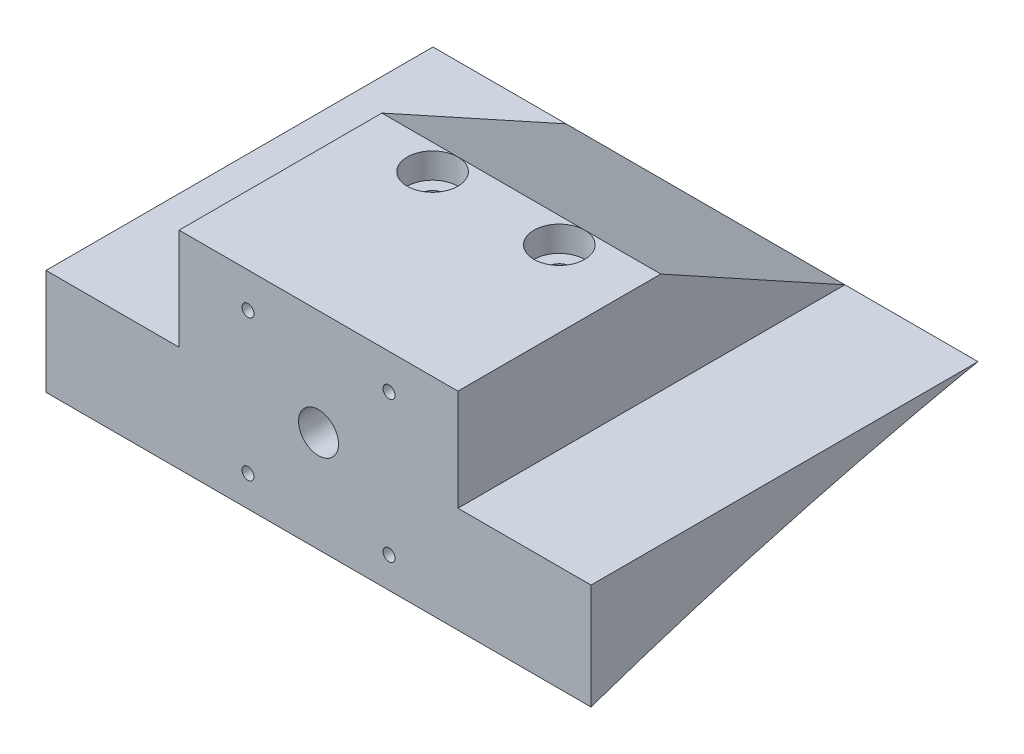
from build123d import *

# Parameters (mm, degrees)
BOSS_EXTRUDE1_DEPTH     = 68.2625
SKETCH4_W               = 69.85
SKETCH4_H               = 25.4
BOSS_EXTRUDE2_DEPTH     = 50.8
CUT_EXTRUDE1_DEPTH      = 364.143790643
CUT_EXTRUDE1_DEPTH_BACK = 364.143790643
SKETCH2_R               = 3.175
SKETCH5_R               = 5
CUT_EXTRUDE2_DEPTH      = 12.7
SKETCH6_R               = 1.5
CUT_EXTRUDE3_DEPTH      = 6.35
CIRPATTERN1_COUNT       = 4
BOSS_EXTRUDE3_DEPTH     = 69.85
SKETCH8_R               = 6.35
CUT_EXTRUDE4_DEPTH      = 6.35


with BuildPart() as part:
    # Sketch1 → Boss-Extrude1 (new, symmetric)
    with BuildSketch(Plane(origin=(0, 0, 0), x_dir=(0, 0, -1), z_dir=(1, 0, 0))):
        with BuildLine():
            Line((-258.749759613, 26.462577976), (-355.687187923, 26.462577976))
            Line((-355.687187923, 26.462577976), (-355.687187923, 0))
            add(Edge.make_bspline(
                [(-355.687187923, 0), (-355.37055154, 0.107976188), (-354.108976481, 0.538185956), (-351.284999827, 1.502859463), (-346.602313416, 3.058862652), (-336.815361237, 6.25189344), (-320.429894612, 11.27779725), (-301.357119069, 16.549630187), (-283.167308194, 21.086195797), (-270.107851124, 24.071552001), (-261.828911243, 25.828285388), (-258.749759613, 26.462577976)],
                knots=[0, 0, 0, 0, 0.001371577, 0.005464776, 0.012234802, 0.021601969, 0.04767125, 0.082496261, 0.102719149, 0.124527079, 0.137415965, 0.137415965, 0.137415965, 0.137415965], degree=3))
        make_face()
    extrude(amount=BOSS_EXTRUDE1_DEPTH, both=True)

    # Sketch4 → Boss-Extrude2 (add)
    with BuildSketch(Plane.XY.offset(355.687187923)):
        with Locations((0, 39.162577976)):
            Rectangle(SKETCH4_W, SKETCH4_H)
    extrude(amount=-BOSS_EXTRUDE2_DEPTH)

    # Sketch2 → Cut-Extrude1 (cut, two sides: drawn at the far end of the back side and taken through both)
    with BuildSketch(Plane(origin=(0, 26.462577976, 0), x_dir=(1, 0, 0), z_dir=(0, 1, 0)).offset(-CUT_EXTRUDE1_DEPTH_BACK)):
        with Locations(Location((-15.875, -311.237187923, 0), (0, 0, 270))):
            Circle(SKETCH2_R)
        with Locations(Location((15.875, -311.237187923, 0), (0, 0, 270))):
            Circle(SKETCH2_R)
    extrude(amount=CUT_EXTRUDE1_DEPTH + CUT_EXTRUDE1_DEPTH_BACK, mode=Mode.SUBTRACT)

    # Sketch5 → Cut-Extrude2 (cut)
    with BuildSketch(Plane.XY.offset(355.687187923)):
        with Locations((0, 25.4)):
            Circle(SKETCH5_R)
    extrude(amount=-CUT_EXTRUDE2_DEPTH, mode=Mode.SUBTRACT)

    # Sketch6 → Cut-Extrude3 (cut)
    with BuildSketch(Plane.XY.offset(355.687187923)):
        with Locations((17.67766953, 43.07766953)):
            Circle(SKETCH6_R)
    cut_extrude3 = extrude(amount=-CUT_EXTRUDE3_DEPTH, mode=Mode.SUBTRACT)

    # CirPattern1: Cut-Extrude3 ×4 about axis
    cirpattern1_axis = Axis((0, 25.4, 0), (0, 0, 1))
    for i in range(1, CIRPATTERN1_COUNT):
        add(cut_extrude3.rotate(cirpattern1_axis, i * 360 / CIRPATTERN1_COUNT), mode=Mode.SUBTRACT)

    # Sketch7 → Boss-Extrude3 (add)
    with BuildSketch(Plane.ZY.offset(34.925)):
        Polygon((304.887187923, 51.862577976), (258.749759613, 26.462577976), (304.887187923, 26.462577976), align=None)
    extrude(amount=-BOSS_EXTRUDE3_DEPTH)

    # Sketch8 → Cut-Extrude4 (cut)
    with BuildSketch(Plane(origin=(0, 51.862577976, 0), x_dir=(1, 0, 0), z_dir=(0, 1, 0))):
        with Locations(Location((15.875, -311.237187923, 0), (0, 0, 270))):
            Circle(SKETCH8_R)
        with Locations(Location((-15.875, -311.237187923, 0), (0, 0, 270))):
            Circle(SKETCH8_R)
    extrude(amount=-CUT_EXTRUDE4_DEPTH, mode=Mode.SUBTRACT)


solid = part.part
